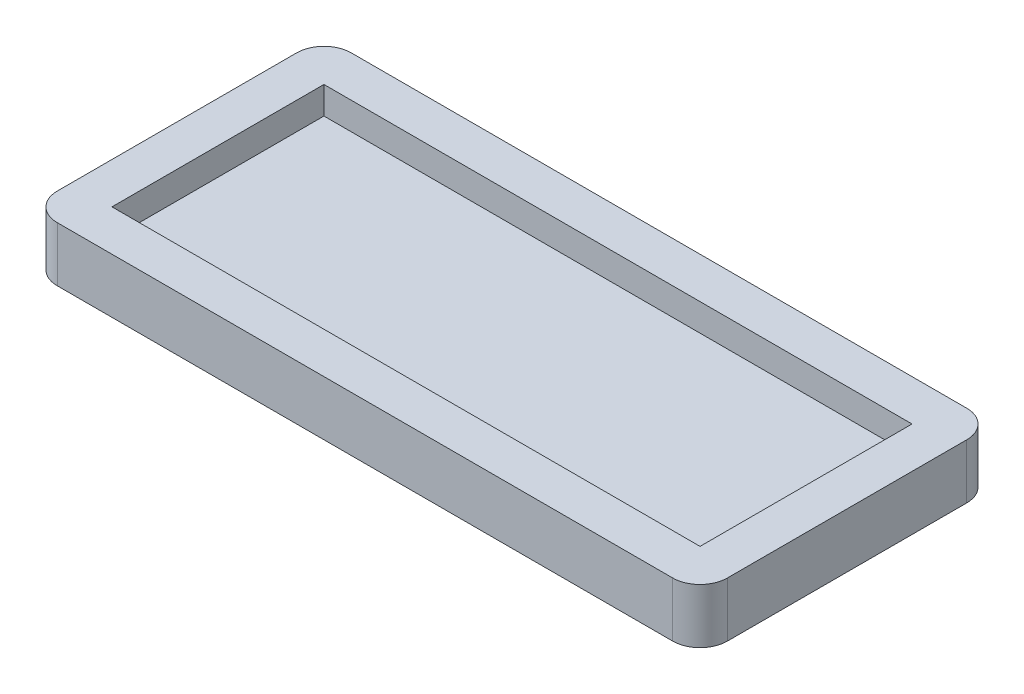
from build123d import *

# Parameters (mm, degrees)
CROQUIS1_W              = 43
CROQUIS1_H              = 15.5
SALIENTE_EXTRUIR1_DEPTH = 2
SALIENTE_EXTRUIR2_START = -2
SALIENTE_EXTRUIR2_DEPTH = 2


with BuildPart() as part:
    # Croquis1 → Saliente-Extruir1 (new body)
    with BuildSketch(Plane(origin=(0, 0, 0), x_dir=(1, 0, 0), z_dir=(0, 1, 0))):
        with BuildLine():
            Line((-24.5, 8.75), (-24.5, -8.75))
            ThreePointArc((-24.5, -8.75), (-23.914213562, -10.164213562), (-22.5, -10.75))
            Line((-22.5, -10.75), (22.5, -10.75))
            ThreePointArc((22.5, -10.75), (23.914213562, -10.164213562), (24.5, -8.75))
            Line((24.5, -8.75), (24.5, 8.75))
            ThreePointArc((24.5, 8.75), (23.914213562, 10.164213562), (22.5, 10.75))
            Line((22.5, 10.75), (-22.5, 10.75))
            ThreePointArc((-22.5, 10.75), (-23.914213562, 10.164213562), (-24.5, 8.75))
        make_face()
        Rectangle(CROQUIS1_W, CROQUIS1_H, mode=Mode.SUBTRACT)
    extrude(amount=SALIENTE_EXTRUIR1_DEPTH)

    # Croquis2 → Saliente-Extruir2 (add)
    with BuildSketch(Plane(origin=(0, 0, 0), x_dir=(1, 0, 0), z_dir=(0, 1, 0)).offset(SALIENTE_EXTRUIR2_START)):
        with BuildLine():
            Line((-24.5, 8.75), (-24.5, -8.75))
            ThreePointArc((-24.5, -8.75), (-23.914213562, -10.164213562), (-22.5, -10.75))
            Line((-22.5, -10.75), (22.5, -10.75))
            ThreePointArc((22.5, -10.75), (23.914213562, -10.164213562), (24.5, -8.75))
            Line((24.5, -8.75), (24.5, 8.75))
            ThreePointArc((24.5, 8.75), (23.914213562, 10.164213562), (22.5, 10.75))
            Line((22.5, 10.75), (-22.5, 10.75))
            ThreePointArc((-22.5, 10.75), (-23.914213562, 10.164213562), (-24.5, 8.75))
        make_face()
    extrude(amount=SALIENTE_EXTRUIR2_DEPTH)


solid = part.part
